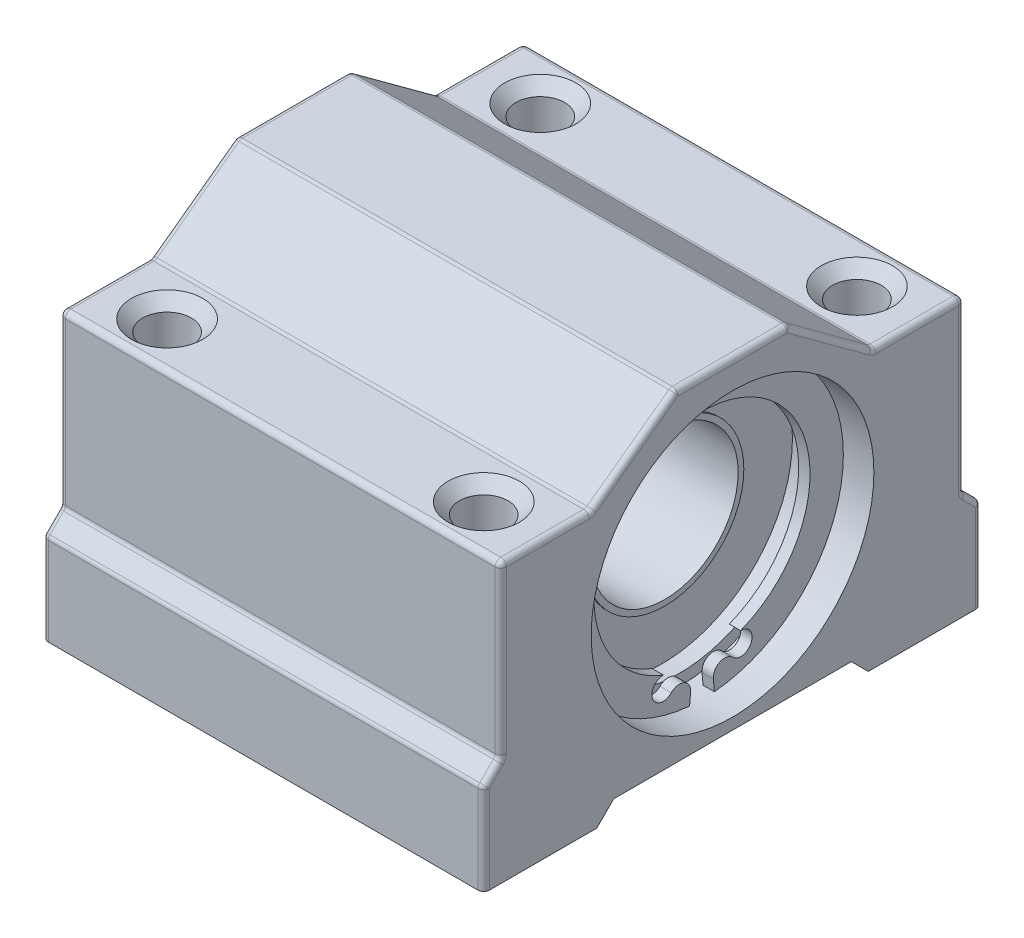
from build123d import *

# Parameters (mm, degrees)
SKETCH1_R           = 12.5
BOSS_EXTRUDE1_DEPTH = 39
EXTRUDE_THIN1_START = 0.5
SKETCH1_4_R         = 7
SKETCH1_4_R_2       = 6.5
EXTRUDE_THIN1_DEPTH = 32.5
BOSS_EXTRUDE2_START = 0.8
SKETCH1_5_R         = 11.5
SKETCH1_5_R_2       = 6.5
BOSS_EXTRUDE2_DEPTH = 32
BOSS_EXTRUDE3_START = 0.3
SKETCH1_6_R         = 12.5
SKETCH1_6_R_2       = 11.5
BOSS_EXTRUDE3_DEPTH = 34
BOSS_EXTRUDE4_START = 1
BOSS_EXTRUDE4_DEPTH = 1
FILLET1_R           = 0.5
SKETCH4_R           = 2.15
CUT_EXTRUDE3_DEPTH  = 54.898051913
CHAMFER1_SIZE       = 1


with BuildPart() as part:
    # Sketch1 → Boss-Extrude1 (new body)
    with BuildSketch(Plane(origin=(0, 0, 0), x_dir=(0, 0, -1), z_dir=(1, 0, 0))):
        Polygon((-22, -15), (-12, -15), (-10.5, -13.5), (10.5, -13.5), (12, -15), (22, -15), (22, -7), (20.5, -5.5), (20.5, 9.5), (12.5, 9.5), (5, 15), (-5, 15), (-12.5, 9.5), (-20.5, 9.5), (-20.5, -5.5), (-22, -7), align=None)
        Circle(SKETCH1_R, mode=Mode.SUBTRACT)
    extrude(amount=BOSS_EXTRUDE1_DEPTH)



with BuildPart() as body_2:
    # Sketch1<4> → Extrude-Thin1 (new body)
    with BuildSketch(Plane(origin=(0, 0, 0), x_dir=(0, 0, -1), z_dir=(1, 0, 0)).offset(EXTRUDE_THIN1_START)):
        Circle(SKETCH1_4_R)
        Circle(SKETCH1_4_R_2, mode=Mode.SUBTRACT)
    extrude(amount=EXTRUDE_THIN1_DEPTH)

    # Sketch1<5> → Boss-Extrude2 (add)
    with BuildSketch(Plane(origin=(0, 0, 0), x_dir=(0, 0, -1), z_dir=(1, 0, 0)).offset(BOSS_EXTRUDE2_START)):
        Circle(SKETCH1_5_R)
        Circle(SKETCH1_5_R_2, mode=Mode.SUBTRACT)
    extrude(amount=BOSS_EXTRUDE2_DEPTH)


with BuildPart() as part_1:
    add(part.part)

    add(body_2.part)  # Boss-Extrude3 merges body 2
    # Sketch1<6> → Boss-Extrude3 (add)
    with BuildSketch(Plane(origin=(0, 0, 0), x_dir=(0, 0, -1), z_dir=(1, 0, 0)).offset(BOSS_EXTRUDE3_START)):
        Circle(SKETCH1_6_R)
        Circle(SKETCH1_6_R_2, mode=Mode.SUBTRACT)
    extrude(amount=BOSS_EXTRUDE3_DEPTH)

    # Sketch3 → Boss-Extrude4 (add)
    with BuildSketch(Plane(origin=(34.3, 0, 0), x_dir=(0, 0, -1), z_dir=(1, 0, 0)).offset(BOSS_EXTRUDE4_START)):
        with BuildLine():
            Line((-1.008608766, -11.455684543), (-1.096313876, -12.451831025))
            ThreePointArc((-1.096313876, -12.451831025), (0, 12.5), (1.096313876, -12.451831025))
            Line((1.096313876, -12.451831025), (1.008608766, -11.455684543))
            ThreePointArc((1.008608766, -11.455684543), (1.561971623, -10.425790507), (2.714072041, -10.624679428))
            ThreePointArc((2.714072041, -10.624679428), (4.353799231, -10.302975473), (3.408913328, -8.924792132))
            ThreePointArc((3.408913328, -8.924792132), (0, 9.553669697), (-3.408913328, -8.924792132))
            ThreePointArc((-3.408913328, -8.924792132), (-4.353799231, -10.302975473), (-2.714072041, -10.624679428))
            ThreePointArc((-2.714072041, -10.624679428), (-1.561971623, -10.425790507), (-1.008608766, -11.455684543))
        make_face()
    extrude(amount=BOSS_EXTRUDE4_DEPTH)

    # Fillet1
    fillet1_edges = [part_1.edges().sort_by_distance(p)[0] for p in [
        (19.5, -5.5, -20.5),
        (19.5, -5.5, 20.5),
        (19.5, -7, 22),
        (19.5, -7, -22),
        (19.5, 9.5, -12.5),
        (19.5, 9.5, 12.5),
        (19.5, 15, 5),
        (19.5, 15, -5),
        (19.5, 9.5, -20.5),
        (19.5, 9.5, 20.5),
        (39, 12.25, -8.75),
        (39, 12.25, 8.75),
        (39, 2, 20.5),
        (0, -6.25, 21.25),
        (0, 12.25, 8.75),
        (39, -6.25, -21.25),
        (39, -11, -22),
        (39, 2, -20.5),
        (39, 15, 0),
        (39, 9.5, -16.5),
        (39, 9.5, 16.5),
        (39, -6.25, 21.25),
        (39, -11, 22),
        (0, -11, -22),
        (0, -6.25, -21.25),
        (0, 2, -20.5),
        (0, 12.25, -8.75),
        (0, 9.5, -16.5),
        (0, 15, 0),
        (0, -11, 22),
        (0, 2, 20.5),
        (0, 9.5, 16.5),
    ]]
    fillet(fillet1_edges, radius=FILLET1_R)

    # Sketch4 → Cut-Extrude3 (cut, through all)
    with BuildSketch(Plane.XZ.offset(15)):
        with Locations((5.5, 16.5)):
            Circle(SKETCH4_R)
        with Locations((33.5, 16.5)):
            Circle(SKETCH4_R)
        with Locations((33.5, -16.5)):
            Circle(SKETCH4_R)
        with Locations((5.5, -16.5)):
            Circle(SKETCH4_R)
    extrude(amount=-CUT_EXTRUDE3_DEPTH, mode=Mode.SUBTRACT)

    # Chamfer1
    chamfer1_edges = [part_1.edges().sort_by_distance(p)[0] for p in [
        (31.35, 9.5, -16.5),
        (3.35, 9.5, -16.5),
        (3.35, 9.5, 16.5),
        (31.35, 9.5, 16.5),
        (31.35, -15, 16.5),
        (3.35, -15, 16.5),
    ]]
    chamfer(chamfer1_edges, length=CHAMFER1_SIZE)


solid = part_1.part
